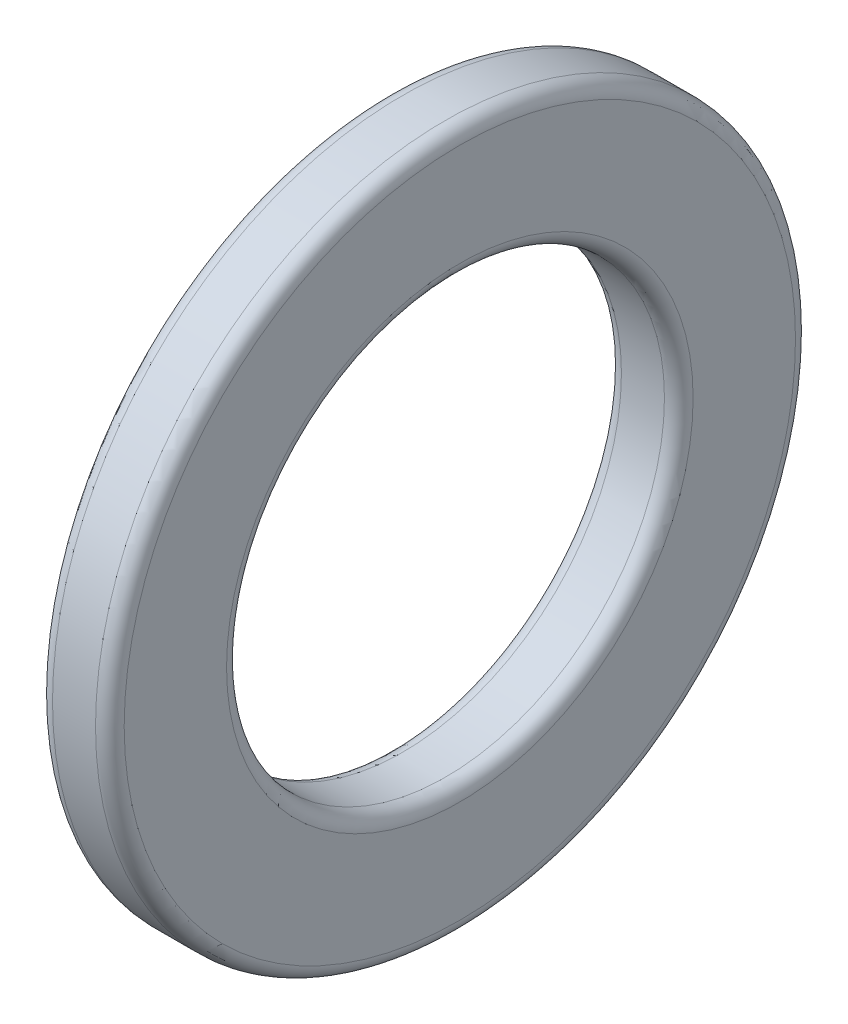
from build123d import *

# Parameters (mm, degrees)
SKETCH1_R           = 7.9375
SKETCH1_R_2         = 4.9657
BOSS_EXTRUDE1_DEPTH = 0.8128
FILLET1_R           = 0.32512


with BuildPart() as part:
    # Sketch1 → Boss-Extrude1 (new, symmetric)
    with BuildSketch(Plane(origin=(0, 0, 0), x_dir=(0, 0, -1), z_dir=(1, 0, 0))):
        Circle(SKETCH1_R)
        Circle(SKETCH1_R_2, mode=Mode.SUBTRACT)
    extrude(amount=BOSS_EXTRUDE1_DEPTH, both=True)

    # Fillet1
    fillet1_edges = [part.edges().sort_by_distance(p)[0] for p in [
        (-0.8128, 0, 7.9375),
        (0.8128, 0, 7.9375),
        (-0.8128, 0, 4.9657),
        (0.8128, 0, 4.9657),
    ]]
    fillet(fillet1_edges, radius=FILLET1_R)


solid = part.part
